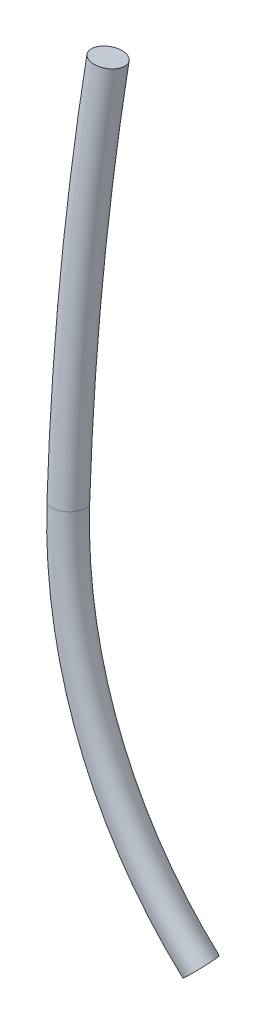
from build123d import *

# Parameters (mm, degrees)
SKETCH3_R = 50.800000001


with BuildPart() as part:
    # Sweep1: sweep along a path in Sketch2
    with BuildLine(Plane(origin=(-3580.59315192, -2177.740819311, -17147.809835371), x_dir=(0.9792109243538111, -0.02386090084351329, -0.2014363994840333), z_dir=(0.20283779285725045, 0.12336730884026248, 0.9714099736456852))) as sweep1_path:
        ThreePointArc((4300.455065065, 493.480774376), (4289.11985753, -115.917423948), (4315.323751407, -724.857492425))
        ThreePointArc((4315.323751407, -724.857492425), (4464.819584118, -1312.627923437), (4807.052919329, -1813.326862761))
    # Sketch3 → Sweep1 (sweep)
    with BuildSketch(Plane(origin=(32.923224106, 697.962867417, -95.514640834), x_dir=(0.9989097115116529, -0.046252832003062905, 0.006329595516537215), z_dir=(-0.04668391851276549, -0.9896856250432939, 0.13543624084770708))):
        with Locations((597.362425847, -18151.964647652)):
            Circle(SKETCH3_R)
    sweep(path=sweep1_path.line)


solid = part.part
